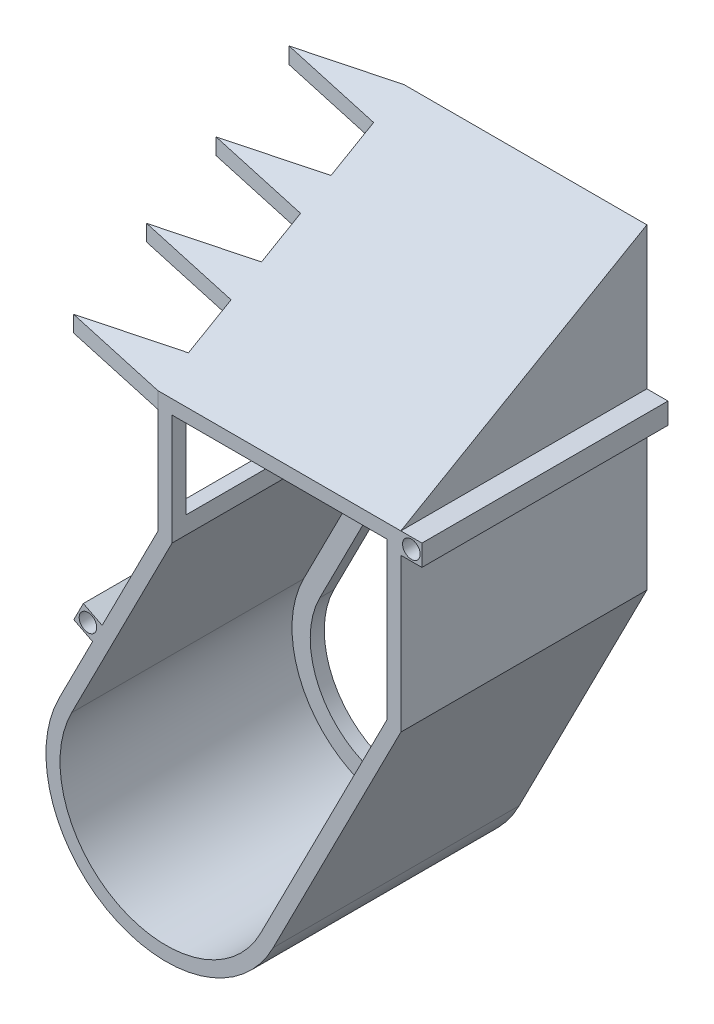
from build123d import *

# Parameters (mm, degrees)
SKETCH1_R           = 3.175
BOSS_EXTRUDE1_DEPTH = 88.9
CUT_EXTRUDE1_DEPTH  = 210.541455785
CUT_EXTRUDE2_DEPTH  = 83.82
CUT_EXTRUDE3_DEPTH  = 82.661206718
BOSS_EXTRUDE2_DEPTH = 5.865878735
SKETCH6_W           = 7.62
SKETCH6_H           = 7.62
SKETCH6_R           = 3.175
BOSS_EXTRUDE3_DEPTH = 88.9


with BuildPart() as part:
    # Sketch1 → Boss-Extrude1 (new body)
    with BuildSketch(Plane.XY):
        with BuildLine():
            Line((-38.875279998, 168.243550653), (48.865926721, 168.243550653))
            Line((48.865926721, 168.243550653), (48.865926721, 53.943550653))
            Line((48.865926721, 53.943550653), (2.740491947, -36.582712205))
            ThreePointArc((2.740491947, -36.582712205), (-55.650204571, -55.55499958), (-74.622491947, 2.835696938))
            Line((-74.622491947, 2.835696938), (-38.875279998, 72.993550653))
            Line((-38.875279998, 72.993550653), (-38.875279998, 168.243550653))
        make_face()
        with Locations((-23.07761236, 59.263499889)):
            Circle(SKETCH1_R, mode=Mode.SUBTRACT)
        with Locations((22.13438764, 59.263499889)):
            Circle(SKETCH1_R, mode=Mode.SUBTRACT)
        with BuildLine():
            Line((-7.651542857, -31.287706), (15.41117453, 13.975425429))
            Line((15.41117453, 13.975425429), (-46.933419103, 31.488039305))
            Line((-46.933419103, 31.488039305), (-64.230457143, -2.459309266))
            ThreePointArc((-64.230457143, -2.459309266), (-50.355198367, -45.162964776), (-7.651542857, -31.287706))
        make_face(mode=Mode.SUBTRACT)
    extrude(amount=BOSS_EXTRUDE1_DEPTH)

    # Sketch2 → Cut-Extrude1 (cut, through all)
    with BuildSketch(Plane.ZY.offset(38.875279998)):
        Polygon((0, 168.243550653), (88.9, 116.917111722), (88.9, 168.243550653), align=None)
    extrude(amount=-CUT_EXTRUDE1_DEPTH, mode=Mode.SUBTRACT)

    # Sketch3 → Cut-Extrude2 (cut)
    with BuildSketch(Plane.XY.offset(88.9)):
        with BuildLine():
            Line((43.785926721, 111.837111722), (-33.795279998, 111.837111722))
            Line((-33.795279998, 111.837111722), (-33.795279998, 71.773950557))
            Line((-33.795279998, 71.773950557), (-70.096178804, 0.5294252))
            ThreePointArc((-70.096178804, 0.5294252), (-53.343932833, -51.028686437), (-1.785821196, -34.276440466))
            Line((-1.785821196, -34.276440466), (43.785926721, 55.163150749))
            Line((43.785926721, 55.163150749), (43.785926721, 111.837111722))
        make_face()
    extrude(amount=-CUT_EXTRUDE2_DEPTH, mode=Mode.SUBTRACT)

    # Sketch4 → Cut-Extrude3 (cut)
    with BuildSketch(Plane.ZY.offset(38.875279998)):
        Polygon((83.82, 78.073550653), (83.82, 113.984172354), (5.08, 159.44473255), (5.08, 78.073550653), align=None)
    extrude(amount=-CUT_EXTRUDE3_DEPTH, mode=Mode.SUBTRACT)

    # Sketch5 → Boss-Extrude2 (add, along a direction that is not the sketch's normal)
    with BuildSketch(Plane(origin=(0, 126.18266299, 72.851594444), x_dir=(1, 0, 0), z_dir=(0, 0.8660254037844417, 0.4999999999999947))):
        Polygon((-38.875279998, 84.121775326), (-74.887919552, 77.771775326), (-38.875279998, 71.421775326), align=None)
        Polygon((-38.875279998, 53.641775326), (-74.887919552, 47.291775326), (-38.875279998, 40.941775326), align=None)
        Polygon((-38.875279998, 24.648897465), (-74.887919552, 18.298897465), (-38.875279998, 11.948897465), align=None)
        Polygon((-38.875279998, -5.831102535), (-74.887919552, -12.181102535), (-38.875279998, -18.531102535), align=None)
    extrude(amount=-BOSS_EXTRUDE2_DEPTH, dir=(0, 1, 0))

    # Sketch6 → Boss-Extrude3 (add)
    # profile 1 of 2: a face of its own
    with BuildSketch(Plane.XY.offset(88.9)):
        with Locations((52.675926721, 113.107111722)):
            Rectangle(SKETCH6_W, SKETCH6_H)
        with Locations((52.675926721, 113.107111722)):
            Circle(SKETCH6_R, mode=Mode.SUBTRACT)
    # profile 2 of 2: a face of its own
    with BuildSketch(Plane.XY.offset(88.9)):
        Polygon((-62.514565319, 26.598840938), (-59.055157711, 33.388310653), (-65.844627425, 36.847718261), (-69.304035033, 30.058248546), align=None)
        with Locations((-64.179596372, 31.7232796)):
            Circle(SKETCH6_R, mode=Mode.SUBTRACT)
    extrude(amount=-BOSS_EXTRUDE3_DEPTH)


solid = part.part
